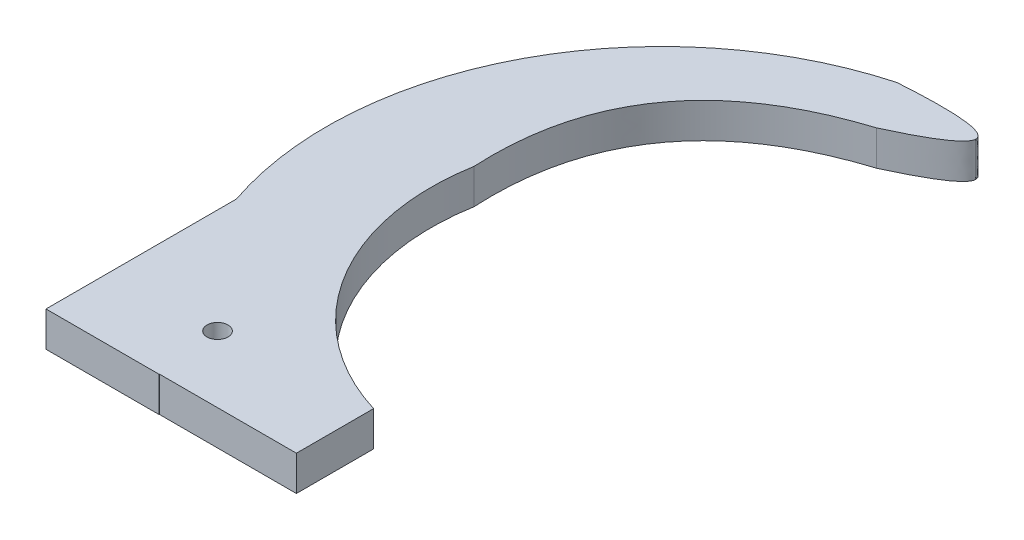
from build123d import *

# Parameters (mm, degrees)
BOSS_EXTRUDE1_DEPTH = 2.5
SKETCH2_W           = 39
SKETCH2_H           = 19
CUT_EXTRUDE2_DEPTH  = 119.291735722
SKETCH6_R           = 1.5
CUT_EXTRUDE11_DEPTH = 119.291735722
CUT_EXTRUDE17_DEPTH = 10
SKETCH17_W          = 77.591598172
SKETCH17_H          = 70.367911795
CUT_EXTRUDE19_DEPTH = 10
CUT_EXTRUDE20_DEPTH = 10
SKETCH18_W          = 37.449354942
SKETCH18_H          = 14.815690613
CUT_EXTRUDE21_DEPTH = 10


with BuildPart() as part:
    # Sketch1 → Boss-Extrude1 (new, symmetric)
    with BuildSketch(Plane(origin=(0, 0, 0), x_dir=(1, 0, 0), z_dir=(0, 1, 0))):
        with BuildLine():
            Line((25.786244138, -33), (0, -33))
            ThreePointArc((0, -33), (-33, 0), (0, 33))
            Line((0, 33), (0, 48))
            ThreePointArc((0, 48), (-39.003855832, 27.976762325), (-45.466733516, -15.387532074))
            Line((-45.466733516, -15.387532074), (-45.466733516, -107.999697871))
            Line((-45.466733516, -107.999697871), (25.786244138, -107.999697871))
            Line((25.786244138, -107.999697871), (25.786244138, -33))
        make_face()
        with BuildLine():
            Line((-7.096269411, -47.472549547), (0, -47.472549547))
            Line((0, -47.472549547), (0, -48))
            ThreePointArc((0, -48), (-3.55792227, -47.867955765), (-7.096269411, -47.472549547))
        make_face(mode=Mode.SUBTRACT)
    extrude(amount=BOSS_EXTRUDE1_DEPTH, both=True)

    # Sketch2 → Cut-Extrude2 (cut, through all)
    with BuildSketch(Plane(origin=(0, 2.5, 0), x_dir=(1, 0, 0), z_dir=(0, 1, 0))):
        with Locations((-9.786245396, -52.095481266)):
            Rectangle(SKETCH2_W, SKETCH2_H)
    extrude(amount=-CUT_EXTRUDE2_DEPTH, mode=Mode.SUBTRACT)

    # Sketch6 → Cut-Extrude11 (cut, through all)
    with BuildSketch(Plane(origin=(0, 2.5, 0), x_dir=(1, 0, 0), z_dir=(0, 1, 0))):
        with Locations(Location((-30.466733516, -33.095481266, 0), (0, 0, 270))):
            Circle(SKETCH6_R)
    extrude(amount=-CUT_EXTRUDE11_DEPTH, mode=Mode.SUBTRACT)

    # Sketch11 → Cut-Extrude17 (cut)
    with BuildSketch(Plane(origin=(0, 2.5, 0), x_dir=(1, 0, 0), z_dir=(0, 1, 0))):
        with BuildLine():
            Line((-8.49120153, 39.220810677), (-8.49120153, 31.888861638))
            Line((-8.49120153, 31.888861638), (-32.514043682, 5.642425314))
            add(Edge.make_bspline(
                [(-32.514043682, 5.642425314), (-33.882768602, 31.207106787), (-8.49120153, 39.220810677)],
                knots=[0, 0, 0, 1, 1, 1], degree=2))
        make_face()
    extrude(amount=-CUT_EXTRUDE17_DEPTH, mode=Mode.SUBTRACT)

    # Sketch17 → Cut-Extrude19 (cut)
    with BuildSketch(Plane(origin=(0, 2.5, 0), x_dir=(1, 0, 0), z_dir=(0, 1, 0))):
        with Locations((-13.009554948, -77.820837223)):
            Rectangle(SKETCH17_W, SKETCH17_H)
    extrude(amount=-CUT_EXTRUDE19_DEPTH, mode=Mode.SUBTRACT)

    # Sketch16 → Cut-Extrude20 (cut)
    with BuildSketch(Plane(origin=(0, 2.5, 0), x_dir=(1, 0, 0), z_dir=(0, 1, 0))):
        with BuildLine():
            Line((0, 33), (0, 44.891139614))
            add(Edge.make_bspline(
                [(-8.49120153, 39.220810677), (-0.101410447, 43.066470158), (0, 44.891139614)],
                knots=[0, 0, 0, 0.444669129, 0.444669129, 0.444669129], degree=2))
            Line((-8.49120153, 39.220810677), (-8.49120153, 31.888861638))
            ThreePointArc((-8.49120153, 31.888861638), (-4.281796699, 32.721036307), (0, 33))
        make_face()
        with BuildLine():
            ThreePointArc((0, 48), (-6.393855284, 47.572246264), (-12.673752424, 46.296608942))
            add(Edge.make_bspline(
                [(0, 44.979230614), (-0.124166201, 47.152790476), (-12.673752424, 46.296608942)],
                knots=[0.455550409, 0.455550409, 0.455550409, 1, 1, 1], degree=2))
            Line((0, 44.979230614), (0, 48))
        make_face()
    extrude(amount=-CUT_EXTRUDE20_DEPTH, mode=Mode.SUBTRACT)

    # Sketch18 → Cut-Extrude21 (cut)
    with BuildSketch(Plane(origin=(0, 2.5, 0), x_dir=(1, 0, 0), z_dir=(0, 1, 0))):
        with Locations((9.041844157, -37.897729007)):
            Rectangle(SKETCH18_W, SKETCH18_H)
    extrude(amount=-CUT_EXTRUDE21_DEPTH, mode=Mode.SUBTRACT)


solid = part.part
